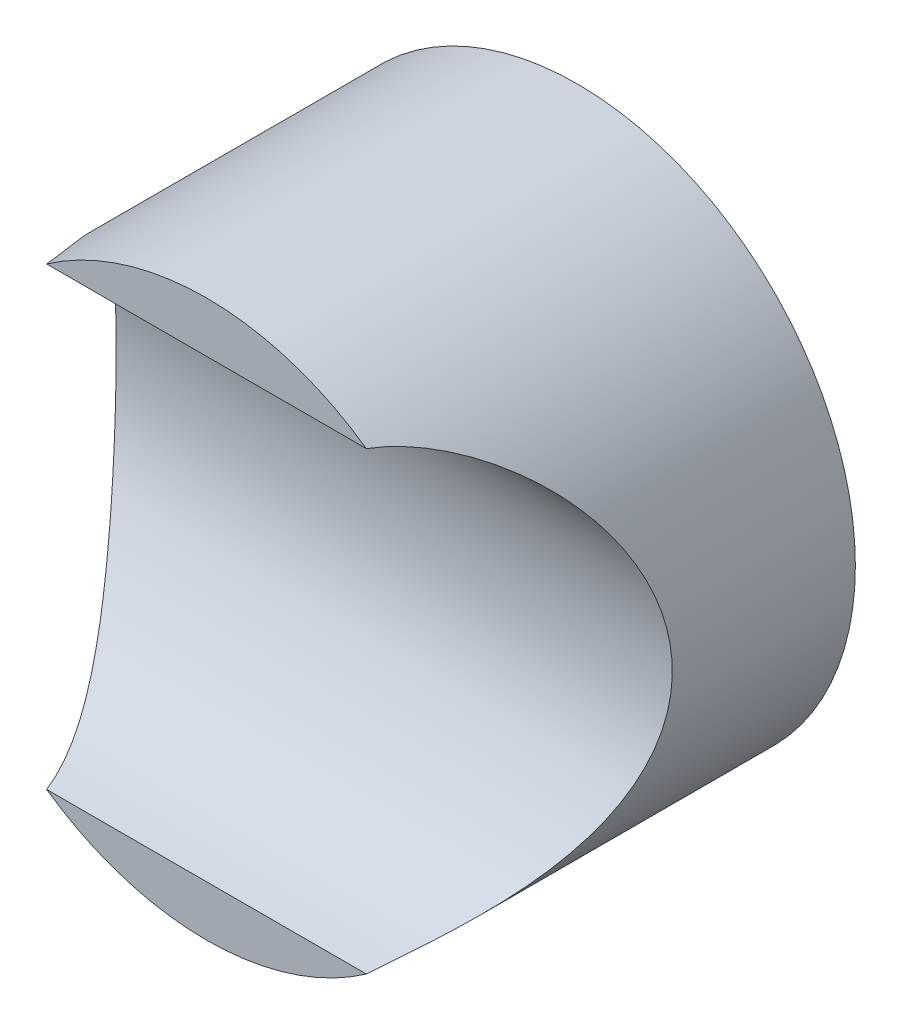
from build123d import *

# Parameters (mm, degrees)
SZKIC1_R                        = 30
DODANIE_WYCI_GNI_CIE1_DEPTH     = 40
WYTNIJ_WYCI_GNI_CIE1_DEPTH      = 59.309518948
WYTNIJ_WYCI_GNI_CIE1_DEPTH_BACK = 59.309518948
SZKIC4_R                        = 10
WYTNIJ_WYCI_GNI_CIE2_DEPTH      = 2


with BuildPart() as part:
    # Szkic1 → Dodanie-wyciągnięcie1 (new body)
    with BuildSketch(Plane.XY):
        Circle(SZKIC1_R)
    extrude(amount=DODANIE_WYCI_GNI_CIE1_DEPTH)

    # Szkic2 → Wytnij-wyciągnięcie1 (cut, two sides: drawn at the far end of the back side and taken through both)
    with BuildSketch(Plane(origin=(0, 0, 0), x_dir=(0, 0, -1), z_dir=(1, 0, 0)).offset(-WYTNIJ_WYCI_GNI_CIE1_DEPTH_BACK)):
        with BuildLine():
            ThreePointArc((-19.746856725, 0), (-25.463814718, 15.911137324), (-40, 24.545210352))
            Line((-40, 24.545210352), (-40, -24.545210352))
            ThreePointArc((-40, -24.545210352), (-25.463814718, -15.911137324), (-19.746856725, 0))
        make_face()
        with BuildLine():
            Line((-40, -24.545210352), (-40, 24.545210352))
            ThreePointArc((-40, 24.545210352), (-69.746856725, 0), (-40, -24.545210352))
        make_face()
    extrude(amount=WYTNIJ_WYCI_GNI_CIE1_DEPTH + WYTNIJ_WYCI_GNI_CIE1_DEPTH_BACK, mode=Mode.SUBTRACT)

    # Szkic4 → Wytnij-wyciągnięcie2 (cut)
    with BuildSketch(Plane(origin=(0, 0, 0), x_dir=(-1, 0, 0), z_dir=(0, 0, -1))):
        Circle(SZKIC4_R)
    extrude(amount=-WYTNIJ_WYCI_GNI_CIE2_DEPTH, mode=Mode.SUBTRACT)


solid = part.part
